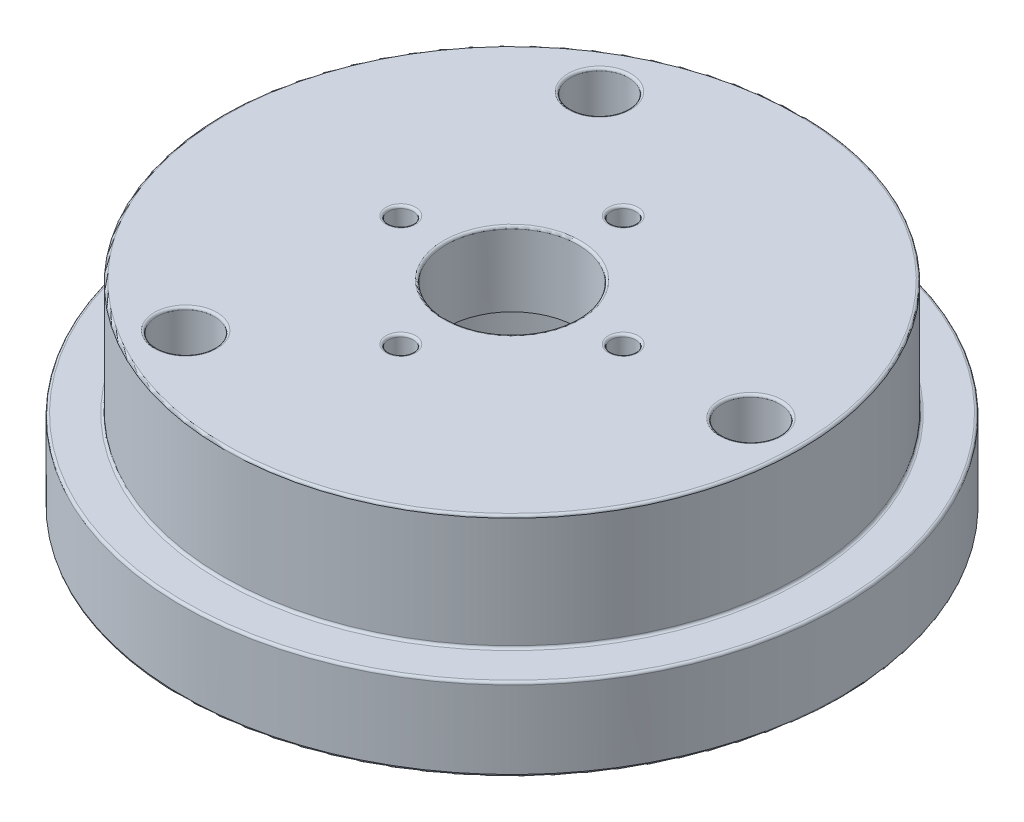
from build123d import *

# Parameters (mm, degrees)
SKETCH_2_R          = 1.75
SKETCH_2_R_2        = 4
SKETCH_2_R_3        = 0.75
CUT_EXTRUDE_1_DEPTH = 31.724582991
SKETCH_2_3_R        = 10
SKETCH_2_3_R_2      = 4
SKETCH_2_3_R_3      = 0.75
SKETCH_2_3_R_4      = 1.75
CUT_EXTRUDE_2_DEPTH = 7.5
FILLET_1_R          = 0.15


with BuildPart() as part:
    # 草图1 → 旋转1 (revolve)
    with BuildSketch(Plane.XY):
        Polygon((0, 0), (-20, 0), (-20, 5), (-17.5, 5), (-17.5, 12), (0, 12), align=None)
    revolve(axis=Axis((0, 12, 0), (0, -1, 0)))

    # 草图2 → 切除-拉伸1 (cut, through all)
    with BuildSketch(Plane.XZ):
        with Locations((14.5, 0)):
            Circle(SKETCH_2_R)
        with Locations((-7.25, -12.557368355)):
            Circle(SKETCH_2_R)
        with Locations((-7.25, 12.557368355)):
            Circle(SKETCH_2_R)
        Circle(SKETCH_2_R_2)
        with Locations((6.75, 0)):
            Circle(SKETCH_2_R_3)
        with Locations((0, -6.75)):
            Circle(SKETCH_2_R_3)
        with Locations((-6.75, 0)):
            Circle(SKETCH_2_R_3)
        with Locations((0, 6.75)):
            Circle(SKETCH_2_R_3)
    extrude(amount=-CUT_EXTRUDE_1_DEPTH, mode=Mode.SUBTRACT)

    # 草图2<3> → 切除-拉伸2 (cut)
    # profile 1 of 4: a face of its own
    with BuildSketch(Plane.XZ):
        Circle(SKETCH_2_3_R)
        Circle(SKETCH_2_3_R_2, mode=Mode.SUBTRACT)
        with Locations((6.75, 0)):
            Circle(SKETCH_2_3_R_3, mode=Mode.SUBTRACT)
        with Locations((0, -6.75)):
            Circle(SKETCH_2_3_R_3, mode=Mode.SUBTRACT)
        with Locations((-6.75, 0)):
            Circle(SKETCH_2_3_R_3, mode=Mode.SUBTRACT)
        with Locations((0, 6.75)):
            Circle(SKETCH_2_3_R_3, mode=Mode.SUBTRACT)
    # profile 2 of 4: a face of its own
    with BuildSketch(Plane.XZ):
        with Locations((14.5, 0)):
            Circle(SKETCH_2_3_R_4)
    # profile 3 of 4: a face of its own
    with BuildSketch(Plane.XZ):
        with Locations((-7.25, -12.557368355)):
            Circle(SKETCH_2_3_R_4)
    # profile 4 of 4: a face of its own
    with BuildSketch(Plane.XZ):
        with Locations((-7.25, 12.557368355)):
            Circle(SKETCH_2_3_R_4)
    extrude(amount=-CUT_EXTRUDE_2_DEPTH, mode=Mode.SUBTRACT)

    # 圆角1
    fillet_1_edges = [part.edges().sort_by_distance(p)[0] for p in [
        (20, 0, 0),
        (-9, 0, 12.557368355),
        (12.75, 0, 0),
        (-9, 0, -12.557368355),
        (-10, 0, 0),
        (17.5, 5, 0),
        (20, 5, 0),
        (17.5, 12, 0),
        (-4, 12, 0),
        (-9, 12, 12.557368355),
        (12.75, 12, 0),
        (-0.75, 12, 6.75),
        (-7.5, 12, 0),
        (6, 12, 0),
        (-0.75, 12, -6.75),
        (-9, 12, -12.557368355),
    ]]
    fillet(fillet_1_edges, radius=FILLET_1_R)


solid = part.part
